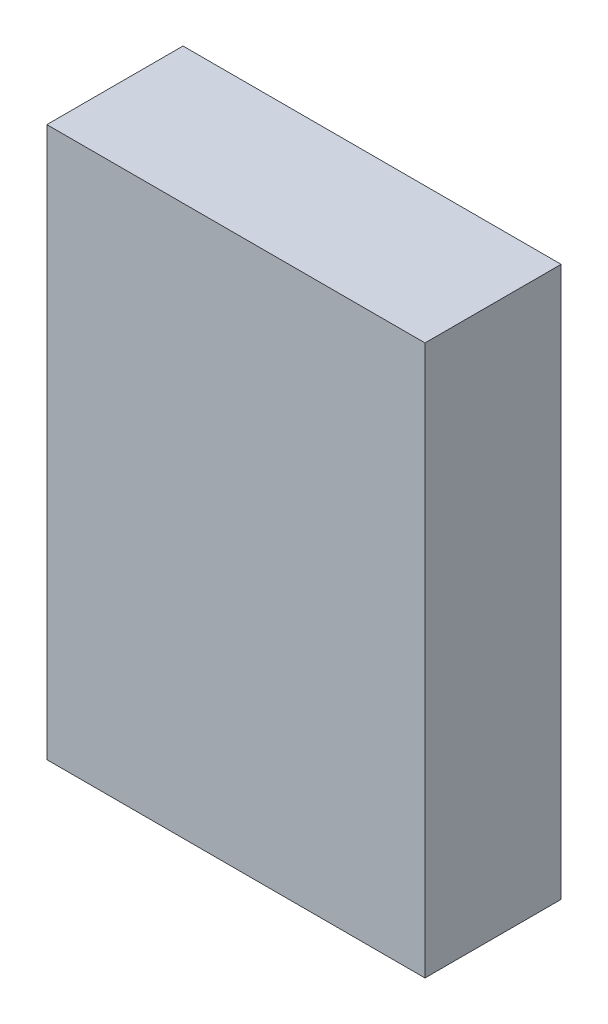
from build123d import *

# Parameters (mm, degrees)
ESTRUSIONE_ESTRUSIONE2_DEPTH      = 3.6
ESTRUSIONE_ESTRUSIONE2_DEPTH_BACK = 36
SCHIZZO1_W                        = 110
SCHIZZO1_H                        = 160
SVUOTA3_T                         = -1
ESTRUSIONE_ESTRUSIONE3_REACH      = 106.475
SCHIZZO32_W                       = 110
SCHIZZO32_H                       = 1


with BuildPart() as part:
    # Schizzo1 → Estrusione-Estrusione2 (new, two sides: drawn at the far end of the back side and taken through both)
    with BuildSketch(Plane.XY.offset(-ESTRUSIONE_ESTRUSIONE2_DEPTH_BACK)):
        Rectangle(SCHIZZO1_W, SCHIZZO1_H)
    extrude(amount=ESTRUSIONE_ESTRUSIONE2_DEPTH + ESTRUSIONE_ESTRUSIONE2_DEPTH_BACK)

    # Svuota3
    svuota3_openings = [part.faces().sort_by_distance(p)[0] for p in [
        (0, 80, -16.2),
    ]]
    offset(amount=SVUOTA3_T, openings=svuota3_openings, kind=Kind.INTERSECTION)

    # Schizzo32 → Estrusione-Estrusione3 (add, up to next)
    with BuildSketch(Plane.XY.offset(-35), mode=Mode.PRIVATE) as estrusione_estrusione3_sk1:
        with Locations((0, 79.5)):
            Rectangle(SCHIZZO32_W, SCHIZZO32_H)
    estrusione_estrusione3_tool1 = extrude(estrusione_estrusione3_sk1.sketch, amount=ESTRUSIONE_ESTRUSIONE3_REACH, mode=Mode.PRIVATE) - part.part
    add(estrusione_estrusione3_tool1.solids().sort_by_distance((0, 79.5, -35))[0])


solid = part.part
